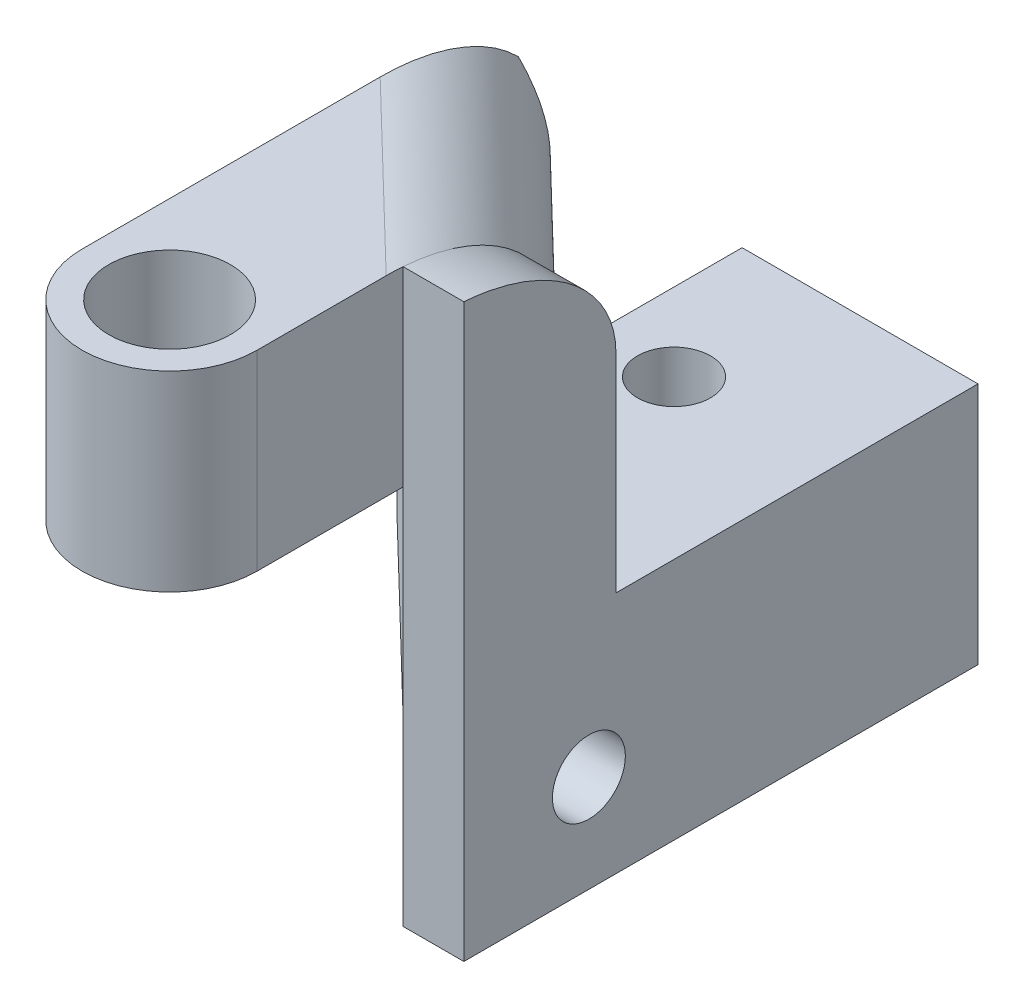
from build123d import *

# Parameters (mm, degrees)
CROQUIS1_R              = 1.5
SALIENTE_EXTRUIR1_DEPTH = 2.5
SALIENTE_EXTRUIR2_START = 8.15
CROQUIS1_3_R            = 2.5
SALIENTE_EXTRUIR2_DEPTH = 7.87
SALIENTE_EXTRUIR5_DEPTH = 16.02
REDONDEO3_R             = 5
CROQUIS8_W              = 21.14
CROQUIS8_H              = 7.5
CROQUIS8_R              = 1.5
SALIENTE_EXTRUIR6_DEPTH = 2.5


with BuildPart() as part:
    # Croquis1 → Saliente-Extruir1 (new body)
    with BuildSketch(Plane(origin=(0, 0, 0), x_dir=(1, 0, 0), z_dir=(0, 1, 0))):
        Polygon((3.6, 27.14), (-3.6, 27.14), (-3.6, 12.952959179), (3.6, 6), align=None)
        with Locations(Location((-0.4, 21.14, 0), (0, 0, 270))):
            Circle(CROQUIS1_R, mode=Mode.SUBTRACT)
    extrude(amount=SALIENTE_EXTRUIR1_DEPTH)



with BuildPart() as body_2:
    # Croquis1<3> → Saliente-Extruir2 (new body)
    with BuildSketch(Plane(origin=(0, 0, 0), x_dir=(1, 0, 0), z_dir=(0, 1, 0)).offset(SALIENTE_EXTRUIR2_START)):
        with BuildLine():
            Line((3.6, 6), (-3.6, 12.952959179))
            Line((-3.6, 12.952959179), (-3.6, 0))
            ThreePointArc((-3.6, 0), (0, -3.6), (3.6, 0))
            Line((3.6, 0), (3.6, 6))
        make_face()
        with Locations(Location((0, 0, 0), (0, 0, 270))):
            Circle(CROQUIS1_3_R, mode=Mode.SUBTRACT)
    extrude(amount=SALIENTE_EXTRUIR2_DEPTH)


with BuildPart() as part_1:
    add(part.part)

    add(body_2.part)  # Saliente-Extruir5 merges body 2
    # Croquis1<6> → Saliente-Extruir5 (add)
    with BuildSketch(Plane(origin=(0, 0, 0), x_dir=(1, 0, 0), z_dir=(0, 1, 0))):
        Polygon((-2.286227518, 17.94), (-3.6, 17.94), (-3.6, 12.952959179), (3.6, 6), (3.6, 12.25573616), align=None)
    extrude(amount=SALIENTE_EXTRUIR5_DEPTH)

    # Redondeo3
    redondeo3_edges = [part_1.edges().sort_by_distance(p)[0] for p in [
        (0.656886241, 16.02, -15.09786808),
    ]]
    fillet(redondeo3_edges, radius=REDONDEO3_R)

    # Croquis8 → Saliente-Extruir6 (add)
    # profile 1 of 2: a face of its own
    with BuildSketch(Plane(origin=(3.6, 0, 0), x_dir=(0, 0, -1), z_dir=(1, 0, 0))):
        with BuildLine():
            Line((6, 15.994937186), (6, 8.15))
            Line((6, 8.15), (6, 0))
            Line((6, 0), (27.14, 0))
            Line((27.14, 0), (27.14, 2.5))
            Line((27.14, 2.5), (12.25573616, 2.5))
            Line((12.25573616, 2.5), (12.25573616, 11.02))
            add(Edge.make_bspline(
                [(12.25573616, 11.02), (12.25573616, 15.542670169), (6, 15.994937186)],
                knots=[3.141592654, 3.141592654, 3.141592654, 4.603302756, 4.603302756, 4.603302756], degree=2, weights=[1, 0.727447175, 0.962144349]))
        make_face()
    # profile 2 of 2: a face of its own
    with BuildSketch(Plane(origin=(3.6, 0, 0), x_dir=(0, 0, -1), z_dir=(1, 0, 0))):
        with Locations((16.57, -3.75)):
            Rectangle(CROQUIS8_W, CROQUIS8_H)
        with Locations((11.14, -3.5)):
            Circle(CROQUIS8_R, mode=Mode.SUBTRACT)
    extrude(amount=SALIENTE_EXTRUIR6_DEPTH)


solid = part_1.part
